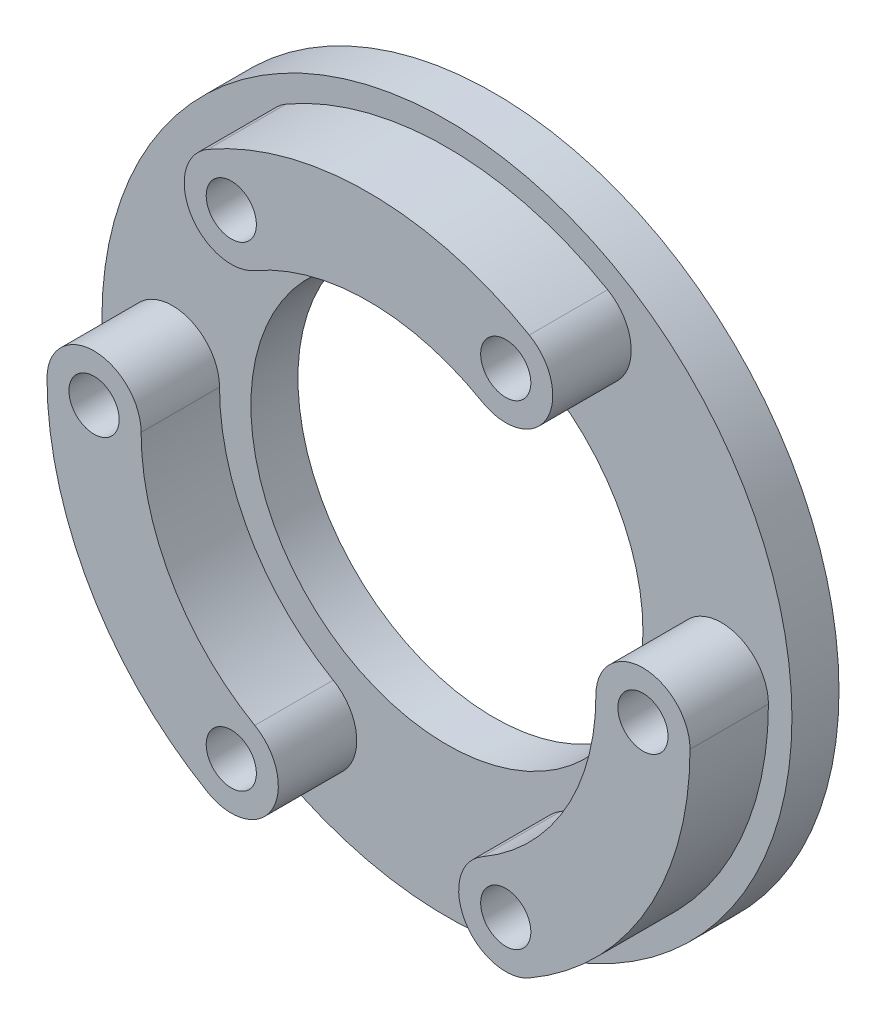
from build123d import *

# Parameters (mm, degrees)
SKETCH_1_R         = 22
SKETCH_1_R_2       = 12.5
EXTRUDE_1_DEPTH    = 3
EXTRUDE_2_DEPTH    = 8
HOLE_WIZARD_M3_1_D = 3.2


with BuildPart() as part:
    # ｽｹｯﾁ1 → ﾎﾞｽ - 押し出し1 (new body)
    with BuildSketch(Plane.XY):
        Circle(SKETCH_1_R)
        Circle(SKETCH_1_R_2, mode=Mode.SUBTRACT)
    extrude(amount=EXTRUDE_1_DEPTH)

    # ｽｹｯﾁ1<4> → ﾎﾞｽ - 押し出し2 (add)
    with BuildSketch(Plane.XY):
        with BuildLine():
            ThreePointArc((7.25, 12.557368355), (11.348076211, 13.655444566), (10.25, 17.753520778))
            ThreePointArc((10.25, 17.753520778), (0, 20.5), (-10.25, 17.753520778))
            ThreePointArc((-10.25, 17.753520778), (-11.348076211, 13.655444566), (-7.25, 12.557368355))
            ThreePointArc((-7.25, 12.557368355), (0, 14.5), (7.25, 12.557368355))
        make_face()
        with BuildLine():
            ThreePointArc((7.25, -12.557368355), (6.151923789, -16.655444566), (10.25, -17.753520778))
            ThreePointArc((10.25, -17.753520778), (17.753520778, -10.25), (20.5, 0))
            ThreePointArc((20.5, 0), (17.5, 3), (14.5, 0))
            ThreePointArc((14.5, 0), (12.557368355, -7.25), (7.25, -12.557368355))
        make_face()
        with BuildLine():
            ThreePointArc((-14.5, 0), (-17.5, 3), (-20.5, 0))
            ThreePointArc((-20.5, 0), (-17.753520778, -10.25), (-10.25, -17.753520778))
            ThreePointArc((-10.25, -17.753520778), (-6.151923789, -16.655444566), (-7.25, -12.557368355))
            ThreePointArc((-7.25, -12.557368355), (-12.557368355, -7.25), (-14.5, 0))
        make_face()
    extrude(amount=EXTRUDE_2_DEPTH)

    # M3 すきま穴1 (through all)
    with Locations(Plane(origin=(8.75, 15.155444566, 0), x_dir=(-1, 0, 0), z_dir=(0, 0, -1))):
        with Locations((0, 0), (-8.75, -15.155444566), (0, -30.310889132), (17.5, -30.310889132), (26.25, -15.155444566), (17.5, 0)):
            Hole(HOLE_WIZARD_M3_1_D / 2)


solid = part.part
